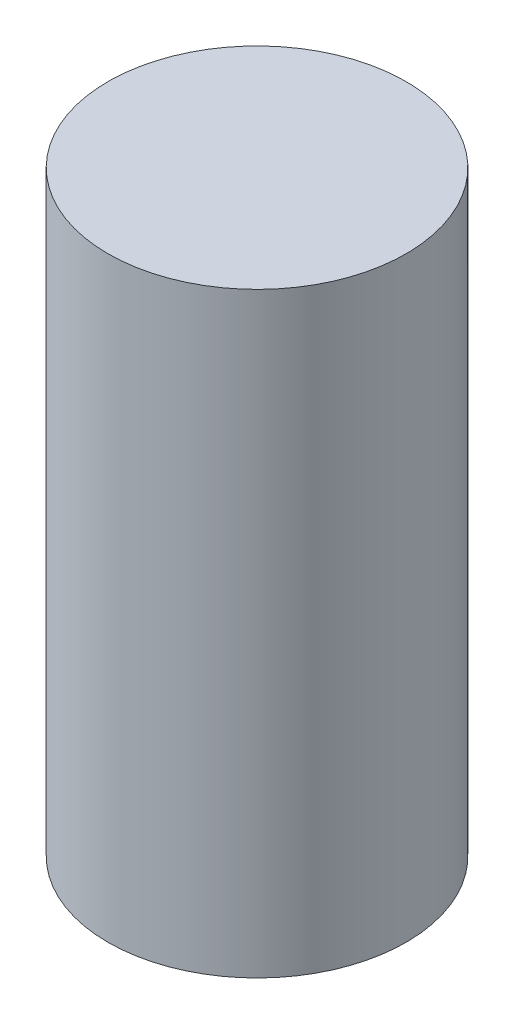
from build123d import *

# Parameters (mm, degrees)
SZKIC1_R                    = 0.5
DODANIE_WYCI_GNI_CIE1_DEPTH = 2


with BuildPart() as part:
    # Szkic1 → Dodanie-wyciągnięcie1 (new body)
    with BuildSketch(Plane(origin=(0, 0, 0), x_dir=(1, 0, 0), z_dir=(0, 1, 0))):
        with Locations(Location((0, 0, 0), (0, 0, 270))):
            Circle(SZKIC1_R)
    extrude(amount=DODANIE_WYCI_GNI_CIE1_DEPTH)


solid = part.part
